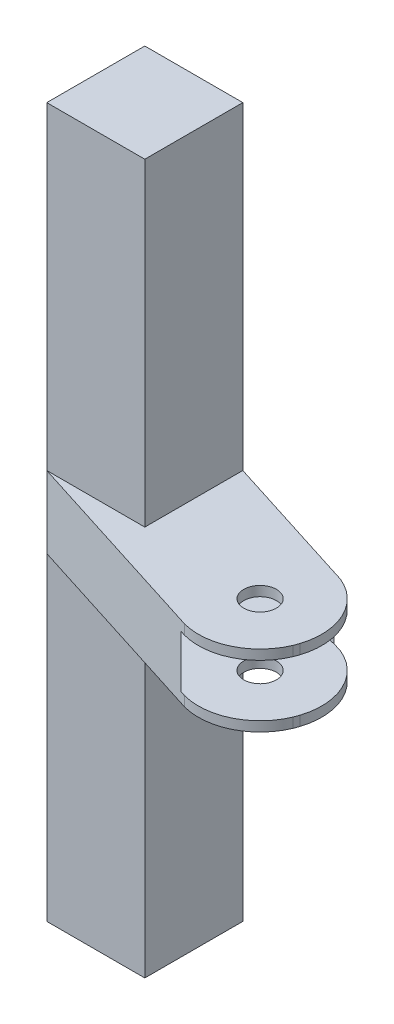
from build123d import *

# Parameters (mm, degrees)
SKETCH1_W           = 30
SKETCH1_H           = 30
BOSS_EXTRUDE1_DEPTH = 217
SKETCH2_R           = 5
BOSS_EXTRUDE3_DEPTH = 119.5
SKETCH2_5_R         = 5
CUT_EXTRUDE1_DEPTH  = 116.5
SKETCH2_6_R         = 5
BOSS_EXTRUDE4_DEPTH = 100.5
SKETCH2_7_R         = 5
CUT_EXTRUDE2_DEPTH  = 97.5


with BuildPart() as part:
    # Sketch1 → Boss-Extrude1 (new body)
    with BuildSketch(Plane(origin=(0, 0, 0), x_dir=(1, 0, 0), z_dir=(0, 1, 0))):
        with Locations((-21.055045872, -9.729357798)):
            Rectangle(SKETCH1_W, SKETCH1_H)
    extrude(amount=BOSS_EXTRUDE1_DEPTH)

    # Sketch2 → Boss-Extrude3 (add)
    with BuildSketch(Plane.XZ):
        with BuildLine():
            Line((-36.055045872, 24.729357798), (-6.055045872, 24.729357798))
            Line((-6.055045872, 24.729357798), (-6.055045872, -5.270642202))
            Line((-6.055045872, -5.270642202), (37.631757216, 8.577867353))
            ThreePointArc((37.631757216, 8.577867353), (47.652639906, 18.060239777), (48.541325909, 31.827727342))
            Line((48.541325909, 31.827727342), (47.968990161, 33.37819141))
            ThreePointArc((47.968990161, 33.37819141), (38.865020701, 43.022901823), (25.663216571, 44.293754521))
            Line((25.663216571, 44.293754521), (-36.055045872, 24.729357798))
        make_face()
        with Locations((30.57150852, 26.07524616)):
            Circle(SKETCH2_R, mode=Mode.SUBTRACT)
    extrude(amount=-BOSS_EXTRUDE3_DEPTH)

    # Sketch2<5> → Cut-Extrude1 (cut)
    with BuildSketch(Plane.XZ):
        with BuildLine():
            Line((25.663216571, 44.293754521), (24.087751056, 43.794339419))
            ThreePointArc((24.087751056, 43.794339419), (20.064375993, 41.747053421), (16.642463995, 38.80266127))
            Line((16.642463995, 38.80266127), (-27.753478769, 24.729357798))
            Line((-27.753478769, 24.729357798), (-6.055045872, 24.729357798))
            Line((-6.055045872, 24.729357798), (-6.055045872, -2.922177327))
            Line((-6.055045872, -2.922177327), (27.800199491, 7.411773197))
            ThreePointArc((27.800199491, 7.411773197), (31.354459639, 7.223393087), (34.880858909, 7.705845626))
            Line((34.880858909, 7.705845626), (37.631757216, 8.577867353))
            ThreePointArc((37.631757216, 8.577867353), (47.652639906, 18.060239777), (48.541325909, 31.827727342))
            Line((48.541325909, 31.827727342), (47.968990161, 33.37819141))
            ThreePointArc((47.968990161, 33.37819141), (38.865020701, 43.022901823), (25.663216571, 44.293754521))
        make_face()
        with Locations((30.57150852, 26.07524616)):
            Circle(SKETCH2_5_R, mode=Mode.SUBTRACT)
    extrude(amount=-CUT_EXTRUDE1_DEPTH, mode=Mode.SUBTRACT)

    # Sketch2<6> → Boss-Extrude4 (add)
    with BuildSketch(Plane.XZ):
        with BuildLine():
            Line((25.663216571, 44.293754521), (24.087751056, 43.794339419))
            ThreePointArc((24.087751056, 43.794339419), (20.064375993, 41.747053421), (16.642463995, 38.80266127))
            Line((16.642463995, 38.80266127), (-27.753478769, 24.729357798))
            Line((-27.753478769, 24.729357798), (-6.055045872, 24.729357798))
            Line((-6.055045872, 24.729357798), (-6.055045872, -2.922177327))
            Line((-6.055045872, -2.922177327), (27.800199491, 7.411773197))
            ThreePointArc((27.800199491, 7.411773197), (31.354459639, 7.223393087), (34.880858909, 7.705845626))
            Line((34.880858909, 7.705845626), (37.631757216, 8.577867353))
            ThreePointArc((37.631757216, 8.577867353), (47.652639906, 18.060239777), (48.541325909, 31.827727342))
            Line((48.541325909, 31.827727342), (47.968990161, 33.37819141))
            ThreePointArc((47.968990161, 33.37819141), (38.865020701, 43.022901823), (25.663216571, 44.293754521))
        make_face()
        with Locations((30.57150852, 26.07524616)):
            Circle(SKETCH2_6_R, mode=Mode.SUBTRACT)
    extrude(amount=-BOSS_EXTRUDE4_DEPTH)

    # Sketch2<7> → Cut-Extrude2 (cut)
    with BuildSketch(Plane.XZ):
        with BuildLine():
            Line((-36.055045872, 24.729357798), (-6.055045872, 24.729357798))
            Line((-6.055045872, 24.729357798), (-6.055045872, -5.270642202))
            Line((-6.055045872, -5.270642202), (37.631757216, 8.577867353))
            ThreePointArc((37.631757216, 8.577867353), (47.652639906, 18.060239777), (48.541325909, 31.827727342))
            Line((48.541325909, 31.827727342), (47.968990161, 33.37819141))
            ThreePointArc((47.968990161, 33.37819141), (38.865020701, 43.022901823), (25.663216571, 44.293754521))
            Line((25.663216571, 44.293754521), (-36.055045872, 24.729357798))
        make_face()
        with Locations((30.57150852, 26.07524616)):
            Circle(SKETCH2_7_R, mode=Mode.SUBTRACT)
    extrude(amount=-CUT_EXTRUDE2_DEPTH, mode=Mode.SUBTRACT)


solid = part.part
